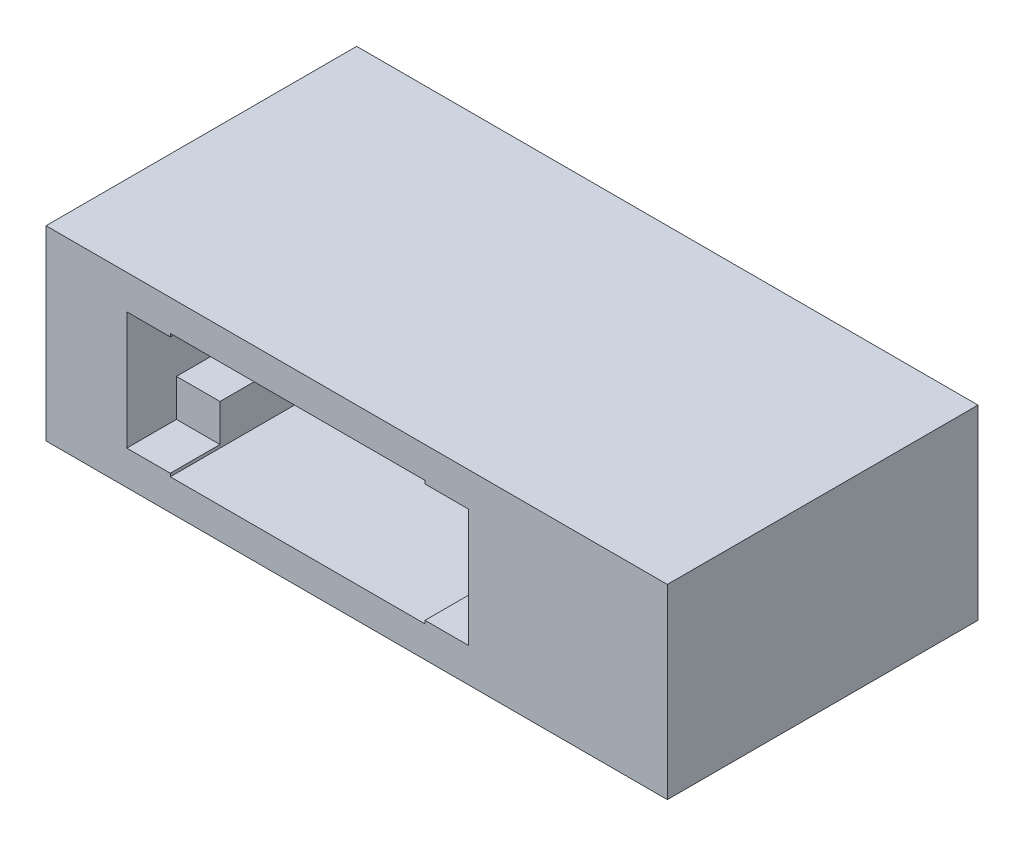
from build123d import *

# Parameters (mm, degrees)
SKETCH_1_W          = 100
SKETCH_1_H          = 30
EXTRUDE_1_DEPTH     = 50
SKETCH_2_W          = 41
SKETCH_2_H          = 20
CUT_EXTRUDE_1_DEPTH = 37
SKETCH_3_W          = 7
SKETCH_3_H          = 19
CUT_EXTRUDE_2_DEPTH = 8
SKETCH_4_W          = 7
SKETCH_4_H          = 7
CUT_EXTRUDE_3_DEPTH = 29
SKETCH_5_W          = 48
SKETCH_5_H          = 7
CUT_EXTRUDE_4_DEPTH = 5
CUT_EXTRUDE_5_REACH = 80.063
SKETCH_6_W          = 5
SKETCH_6_H          = 7
CUT_EXTRUDE_6_REACH = 84.643
SKETCH_7_R          = 2.5


with BuildPart() as part:
    # 草圖1 → 填料-伸長1 (new body)
    with BuildSketch(Plane.XY):
        with Locations((13.030079174, 3.895348837)):
            Rectangle(SKETCH_1_W, SKETCH_1_H)
    extrude(amount=EXTRUDE_1_DEPTH)

    # 草圖2 → 除料-伸長1 (cut)
    with BuildSketch(Plane.XY.offset(50)):
        with Locations((3.530079174, 3.895348837)):
            Rectangle(SKETCH_2_W, SKETCH_2_H)
    extrude(amount=-CUT_EXTRUDE_1_DEPTH, mode=Mode.SUBTRACT)

    # 草圖3 → 除料-伸長2 (cut)
    with BuildSketch(Plane.XY.offset(50)):
        with Locations((27.530079174, 3.895348837)):
            Rectangle(SKETCH_3_W, SKETCH_3_H)
        with Locations((-20.469920826, 3.895348837)):
            Rectangle(SKETCH_3_W, SKETCH_3_H)
    extrude(amount=-CUT_EXTRUDE_2_DEPTH, mode=Mode.SUBTRACT)

    # 草圖4 → 除料-伸長3 (cut)
    with BuildSketch(Plane.XY.offset(42)):
        with Locations((-20.469920826, 3.895348837)):
            Rectangle(SKETCH_4_W, SKETCH_4_H)
    extrude(amount=-CUT_EXTRUDE_3_DEPTH, mode=Mode.SUBTRACT)

    # 草圖5 → 除料-伸長4 (cut)
    with BuildSketch(Plane.XY.offset(13)):
        with Locations((0.030079174, 3.895348837)):
            Rectangle(SKETCH_5_W, SKETCH_5_H)
    extrude(amount=-CUT_EXTRUDE_4_DEPTH, mode=Mode.SUBTRACT)

    # 草圖6 → 除料-伸長5 (cut, up to next)
    with BuildSketch(Plane.XY.offset(8), mode=Mode.PRIVATE) as cut_extrude_5_sk1:
        with Locations((21.530079174, 3.895348837)):
            Rectangle(SKETCH_6_W, SKETCH_6_H)
    cut_extrude_5_tool1 = extrude(cut_extrude_5_sk1.sketch, amount=-CUT_EXTRUDE_5_REACH, mode=Mode.PRIVATE) & part.part
    add(cut_extrude_5_tool1.solids().sort_by_distance((21.530079, 3.895349, 8))[0], mode=Mode.SUBTRACT)

    # 草圖7 → 除料-伸長6 (cut, up to next)
    with BuildSketch(Plane(origin=(0, 0, 0), x_dir=(-1, 0, 0), z_dir=(0, 0, -1)), mode=Mode.PRIVATE) as cut_extrude_6_sk1:
        with Locations((7.969920826, 3.895348837)):
            Circle(SKETCH_7_R)
    cut_extrude_6_tool1 = extrude(cut_extrude_6_sk1.sketch, amount=-CUT_EXTRUDE_6_REACH, mode=Mode.PRIVATE) & part.part
    add(cut_extrude_6_tool1.solids().sort_by_distance((-7.969921, 3.895349, 0))[0], mode=Mode.SUBTRACT)


solid = part.part
